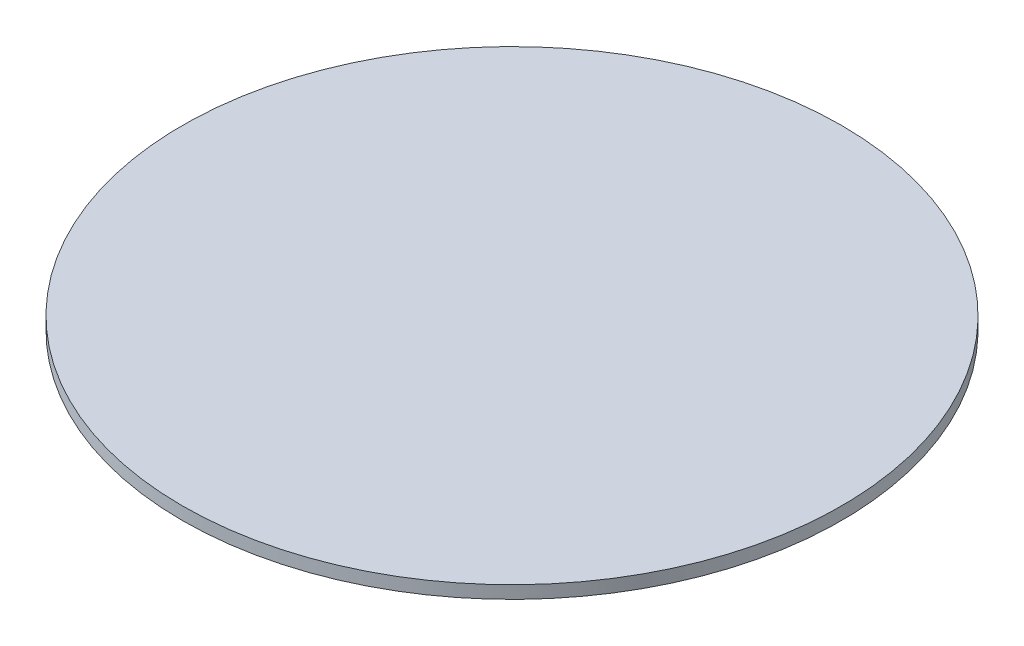
from build123d import *

# Parameters (mm, degrees)
SKETCH1_R           = 65.769791736
BOSS_EXTRUDE1_DEPTH = 2.54


with BuildPart() as part:
    # Sketch1 → Boss-Extrude1 (new body)
    with BuildSketch(Plane(origin=(0, 0, 0), x_dir=(1, 0, 0), z_dir=(0, 1, 0))):
        with Locations(Location((0, 0, 0), (0, 0, 270))):
            Circle(SKETCH1_R)
    extrude(amount=BOSS_EXTRUDE1_DEPTH)


solid = part.part
